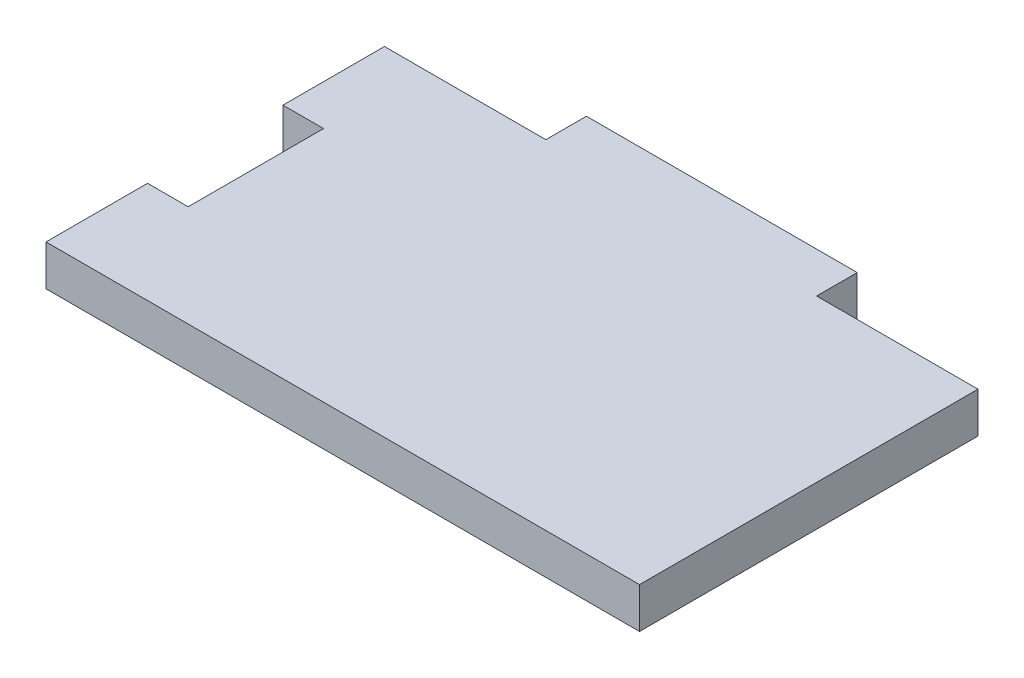
from build123d import *

# Parameters (mm, degrees)
SKETCH1_W           = 87.675190279
SKETCH1_H           = 6
BOSS_EXTRUDE1_DEPTH = 50
SKETCH1_3_W         = 40
SKETCH1_3_H         = 6
BOSS_EXTRUDE2_DEPTH = 6
SKETCH2_W           = 6
SKETCH2_H           = 20
CUT_EXTRUDE1_DEPTH  = 6


with BuildPart() as part:
    # Sketch1 → Boss-Extrude1 (new body)
    with BuildSketch(Plane.XY):
        with Locations((-11.018263017, -38.008278224)):
            Rectangle(SKETCH1_W, SKETCH1_H)
    extrude(amount=BOSS_EXTRUDE1_DEPTH)

    # Sketch1<3> → Boss-Extrude2 (add)
    with BuildSketch(Plane.XY):
        with Locations((-11.018263016, -38.008278224)):
            Rectangle(SKETCH1_3_W, SKETCH1_3_H)
    extrude(amount=-BOSS_EXTRUDE2_DEPTH)

    # Sketch2 → Cut-Extrude1 (cut)
    with BuildSketch(Plane(origin=(0, -35.008278224, 0), x_dir=(1, 0, 0), z_dir=(0, 1, 0))):
        with Locations((-51.855858156, -25)):
            Rectangle(SKETCH2_W, SKETCH2_H)
    extrude(amount=-CUT_EXTRUDE1_DEPTH, mode=Mode.SUBTRACT)


solid = part.part
